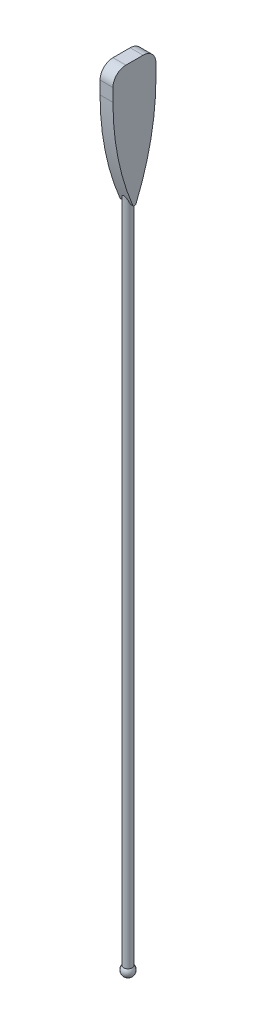
from build123d import *

# Parameters (mm, degrees)
BOSS_EXTRUDE1_DEPTH = 0.375


with BuildPart() as part:
    # Sketch1 → Revolve1 (revolve)
    with BuildSketch(Plane.XY):
        with BuildLine():
            Line((0.25, 0.226271737), (0.25, 46))
            Line((0.25, 46), (0, 46))
            Line((0, 46), (0, -0.337192673))
            ThreePointArc((0, -0.337192673), (0.308217513, -0.136751101), (0.25, 0.226271737))
        make_face()
    revolve(axis=Axis((0, 46, 0), (0, -1, 0)))

    # Sketch3 → Boss-Extrude1 (add, symmetric)
    with BuildSketch(Plane(origin=(0, 0, 0), x_dir=(0, 0, -1), z_dir=(1, 0, 0))):
        with BuildLine():
            Line((1.25, 44.5), (1.25, 45.25))
            ThreePointArc((1.25, 45.25), (1.030330086, 45.780330086), (0.5, 46))
            Line((0.5, 46), (-0.5, 46))
            ThreePointArc((-0.5, 46), (-1.030330086, 45.780330086), (-1.25, 45.25))
            Line((-1.25, 45.25), (-1.25, 44.5))
            ThreePointArc((-1.25, 44.5), (-0.95772294, 41.553326298), (-0.092281879, 38.721485279))
            ThreePointArc((-0.092281879, 38.721485279), (0, 38.660008711), (0.092281879, 38.721485279))
            ThreePointArc((0.092281879, 38.721485279), (0.95772294, 41.553326298), (1.25, 44.5))
        make_face()
    extrude(amount=BOSS_EXTRUDE1_DEPTH, both=True)


solid = part.part
